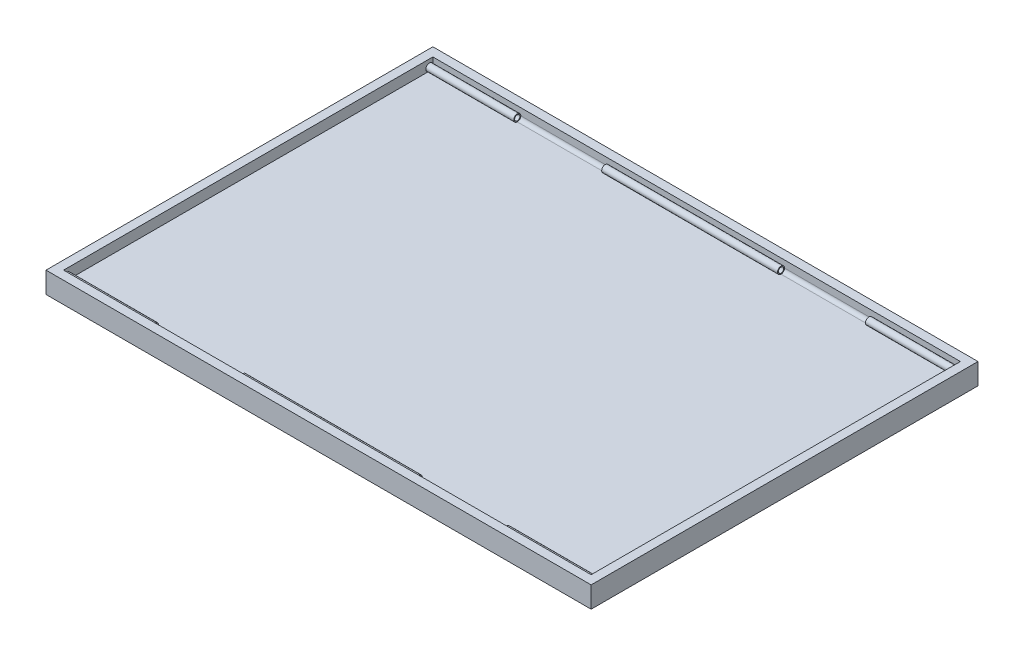
from build123d import *

# Parameters (mm, degrees)
SKETCH_1_W          = 310
SKETCH_1_H          = 220
EXTRUDE_1_DEPTH     = 12
SKETCH_2_W          = 300
SKETCH_2_H          = 210
CUT_EXTRUDE_4_DEPTH = 6
SKETCH_6_W          = 300
SKETCH_6_H          = 2
EXTRUDE_3_DEPTH     = 2
SKETCH_8_R          = 2
CUT_EXTRUDE_5_DEPTH = 300
SKETCH_8_2_R        = 2
SKETCH_8_2_R_2      = 1.5
EXTRUDE_1_2_DEPTH   = 300
SKETCH_10_R         = 2
CUT_EXTRUDE_6_DEPTH = 300
SKETCH_10_2_R       = 2
SKETCH_10_2_R_2     = 1.5
EXTRUDE_2_DEPTH     = 300
SKETCH_12_R         = 2
CUT_EXTRUDE_7_DEPTH = 50
SKETCH_13_R         = 2
CUT_EXTRUDE_8_DEPTH = 50


with BuildPart() as part:
    # 草图1 → Extrude 1 (new body)
    with BuildSketch(Plane(origin=(0, 0, 0), x_dir=(1, 0, 0), z_dir=(0, 1, 0))):
        with Locations((0.660377358, 22.830188679)):
            Rectangle(SKETCH_1_W, SKETCH_1_H)
    extrude(amount=EXTRUDE_1_DEPTH)

    # 草图2 → 切除-拉伸4 (cut)
    with BuildSketch(Plane(origin=(0, 12, 0), x_dir=(1, 0, 0), z_dir=(0, 1, 0))):
        with Locations((0.660377358, 22.830188679)):
            Rectangle(SKETCH_2_W, SKETCH_2_H)
    extrude(amount=-CUT_EXTRUDE_4_DEPTH, mode=Mode.SUBTRACT)

    # 草图6 → 凸台-拉伸3 (add)
    with BuildSketch(Plane(origin=(0, 6, 0), x_dir=(1, 0, 0), z_dir=(0, 1, 0))):
        with Locations((0.660377358, 126.830188679)):
            Rectangle(SKETCH_6_W, SKETCH_6_H)
        with Locations((0.660377358, -81.169811321)):
            Rectangle(SKETCH_6_W, SKETCH_6_H)
    extrude(amount=EXTRUDE_3_DEPTH)

    # 草图8 → 切除-拉伸5 (cut)
    with BuildSketch(Plane(origin=(150.660377358, 0, 0), x_dir=(0, 0, -1), z_dir=(1, 0, 0))):
        with Locations((-80.169811321, 8)):
            Circle(SKETCH_8_R)
    extrude(amount=-CUT_EXTRUDE_5_DEPTH, mode=Mode.SUBTRACT)

    # 草图8<2> → Extrude 1 2 (add)
    with BuildSketch(Plane(origin=(150.660377358, 0, 0), x_dir=(0, 0, -1), z_dir=(1, 0, 0))):
        with Locations((-80.169811321, 8)):
            Circle(SKETCH_8_2_R)
        with Locations((-80.169811321, 8)):
            Circle(SKETCH_8_2_R_2, mode=Mode.SUBTRACT)
    extrude(amount=-EXTRUDE_1_2_DEPTH)

    # 草图10 → 切除-拉伸6 (cut)
    with BuildSketch(Plane(origin=(150.660377358, 0, 0), x_dir=(0, 0, -1), z_dir=(1, 0, 0))):
        with Locations((125.830188679, 8)):
            Circle(SKETCH_10_R)
    extrude(amount=-CUT_EXTRUDE_6_DEPTH, mode=Mode.SUBTRACT)

    # 草图10<2> → 拉伸-薄壁2 (add)
    with BuildSketch(Plane(origin=(150.660377358, 0, 0), x_dir=(0, 0, -1), z_dir=(1, 0, 0))):
        with Locations((125.830188679, 8)):
            Circle(SKETCH_10_2_R)
        with Locations((125.830188679, 8)):
            Circle(SKETCH_10_2_R_2, mode=Mode.SUBTRACT)
    extrude(amount=-EXTRUDE_2_DEPTH)

    # 草图12 → 切除-拉伸7 (cut)
    with BuildSketch(Plane(origin=(100.660377358, 0, 0), x_dir=(0, 0, -1), z_dir=(1, 0, 0))):
        with Locations((-80.169811321, 8)):
            Circle(SKETCH_12_R)
        with Locations((125.830188679, 8)):
            Circle(SKETCH_12_R)
    extrude(amount=-CUT_EXTRUDE_7_DEPTH, mode=Mode.SUBTRACT)

    # 草图13 → 切除-拉伸8 (cut)
    with BuildSketch(Plane(origin=(-49.339622642, 0, 0), x_dir=(0, 0, -1), z_dir=(1, 0, 0))):
        with Locations((-80.169811321, 8)):
            Circle(SKETCH_13_R)
        with Locations((125.830188679, 8)):
            Circle(SKETCH_13_R)
    extrude(amount=-CUT_EXTRUDE_8_DEPTH, mode=Mode.SUBTRACT)


solid = part.part
